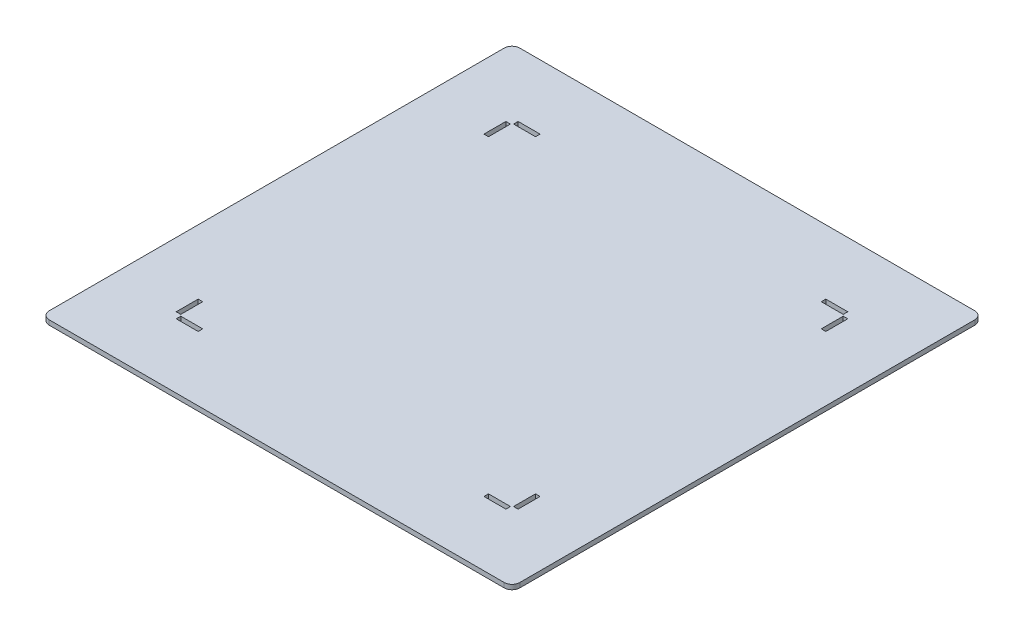
from build123d import *

# Parameters (mm, degrees)
SKETCH1_W           = 300
SKETCH1_H           = 300
SKETCH1_W_2         = 2.9
SKETCH1_H_2         = 14
SKETCH1_W_3         = 14
SKETCH1_H_3         = 2.9
BOSS_EXTRUDE1_DEPTH = 3
FILLET1_R           = 5


with BuildPart() as part:
    # Sketch1 → Boss-Extrude1 (new body)
    with BuildSketch(Plane(origin=(0, 0, 0), x_dir=(1, 0, 0), z_dir=(0, 1, 0))):
        Rectangle(SKETCH1_W, SKETCH1_H)
        with Locations((107.516017178, -98.066017178)):
            Rectangle(SKETCH1_W_2, SKETCH1_H_2, mode=Mode.SUBTRACT)
        with Locations((98.066017178, 107.516017178)):
            Rectangle(SKETCH1_W_3, SKETCH1_H_3, mode=Mode.SUBTRACT)
        with Locations((107.516017178, 98.066017178)):
            Rectangle(SKETCH1_W_2, SKETCH1_H_2, mode=Mode.SUBTRACT)
        with Locations((98.066017178, -107.516017178)):
            Rectangle(SKETCH1_W_3, SKETCH1_H_3, mode=Mode.SUBTRACT)
        with Locations((-98.066017178, -107.516017178)):
            Rectangle(SKETCH1_W_3, SKETCH1_H_3, mode=Mode.SUBTRACT)
        with Locations((-107.516017178, -98.066017178)):
            Rectangle(SKETCH1_W_2, SKETCH1_H_2, mode=Mode.SUBTRACT)
        with Locations((-107.516017178, 98.066017178)):
            Rectangle(SKETCH1_W_2, SKETCH1_H_2, mode=Mode.SUBTRACT)
        with Locations((-98.066017178, 107.516017178)):
            Rectangle(SKETCH1_W_3, SKETCH1_H_3, mode=Mode.SUBTRACT)
    extrude(amount=BOSS_EXTRUDE1_DEPTH)

    # Fillet1
    fillet1_edges = [part.edges().sort_by_distance(p)[0] for p in [
        (-150, 1.5, -150),
        (150, 1.5, -150),
        (150, 1.5, 150),
        (-150, 1.5, 150),
    ]]
    fillet(fillet1_edges, radius=FILLET1_R)


solid = part.part
